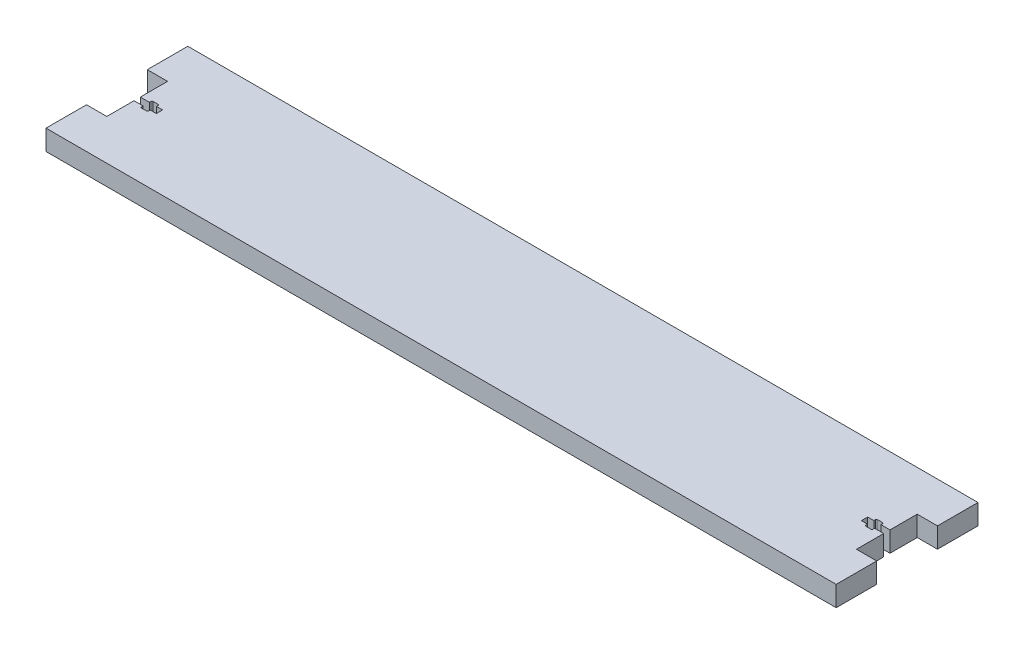
from build123d import *

# Parameters (mm, degrees)
SKETCH1_W           = 370
SKETCH1_H           = 70
BOSS_EXTRUDE1_DEPTH = 10
SKETCH2_W           = 10
SKETCH2_H           = 20
BOSS_EXTRUDE2_DEPTH = 10
CUT_EXTRUDE1_DEPTH  = 199.368344249


with BuildPart() as part:
    # Sketch1 → Boss-Extrude1 (new body)
    with BuildSketch(Plane(origin=(0, 0, 0), x_dir=(1, 0, 0), z_dir=(0, 1, 0))):
        Rectangle(SKETCH1_W, SKETCH1_H)
    extrude(amount=BOSS_EXTRUDE1_DEPTH)

    # Sketch2 → Boss-Extrude2 (add, through all)
    with BuildSketch(Plane(origin=(0, 10, 0), x_dir=(1, 0, 0), z_dir=(0, 1, 0))):
        with Locations((190, 25)):
            Rectangle(SKETCH2_W, SKETCH2_H)
        with Locations((190, -25)):
            Rectangle(SKETCH2_W, SKETCH2_H)
    boss_extrude2 = extrude(amount=-BOSS_EXTRUDE2_DEPTH)

    # Sketch3 → Cut-Extrude1 (cut, through all)
    with BuildSketch(Plane(origin=(0, 10, 0), x_dir=(1, 0, 0), z_dir=(0, 1, 0))):
        with BuildLine():
            Line((185, -1.55), (185, 1.55))
            Line((185, 1.55), (180.5, 1.55))
            Line((180.5, 1.55), (180.5, 2.35))
            ThreePointArc((180.5, 2.35), (180.353553391, 2.703553391), (180, 2.85))
            Line((180, 2.85), (177.5, 2.85))
            ThreePointArc((177.5, 2.85), (177.146446609, 2.703553391), (177, 2.35))
            Line((177, 2.35), (177, 1.55))
            Line((177, 1.55), (174, 1.55))
            Line((174, 1.55), (174, -1.55))
            Line((174, -1.55), (177, -1.55))
            Line((177, -1.55), (177, -2.35))
            ThreePointArc((177, -2.35), (177.146446609, -2.703553391), (177.5, -2.85))
            Line((177.5, -2.85), (180, -2.85))
            ThreePointArc((180, -2.85), (180.353553391, -2.703553391), (180.5, -2.35))
            Line((180.5, -2.35), (180.5, -1.55))
            Line((180.5, -1.55), (185, -1.55))
        make_face()
    cut_extrude1 = extrude(amount=-CUT_EXTRUDE1_DEPTH, mode=Mode.SUBTRACT)

    # Mirror1: Boss-Extrude2, Cut-Extrude1 across plane
    add(boss_extrude2.mirror(Plane(origin=(0, 0, 0), x_dir=(0, 0, 1), z_dir=(1, 0, 0))))
    add(cut_extrude1.mirror(Plane(origin=(0, 0, 0), x_dir=(0, 0, 1), z_dir=(1, 0, 0))), mode=Mode.SUBTRACT)


solid = part.part
